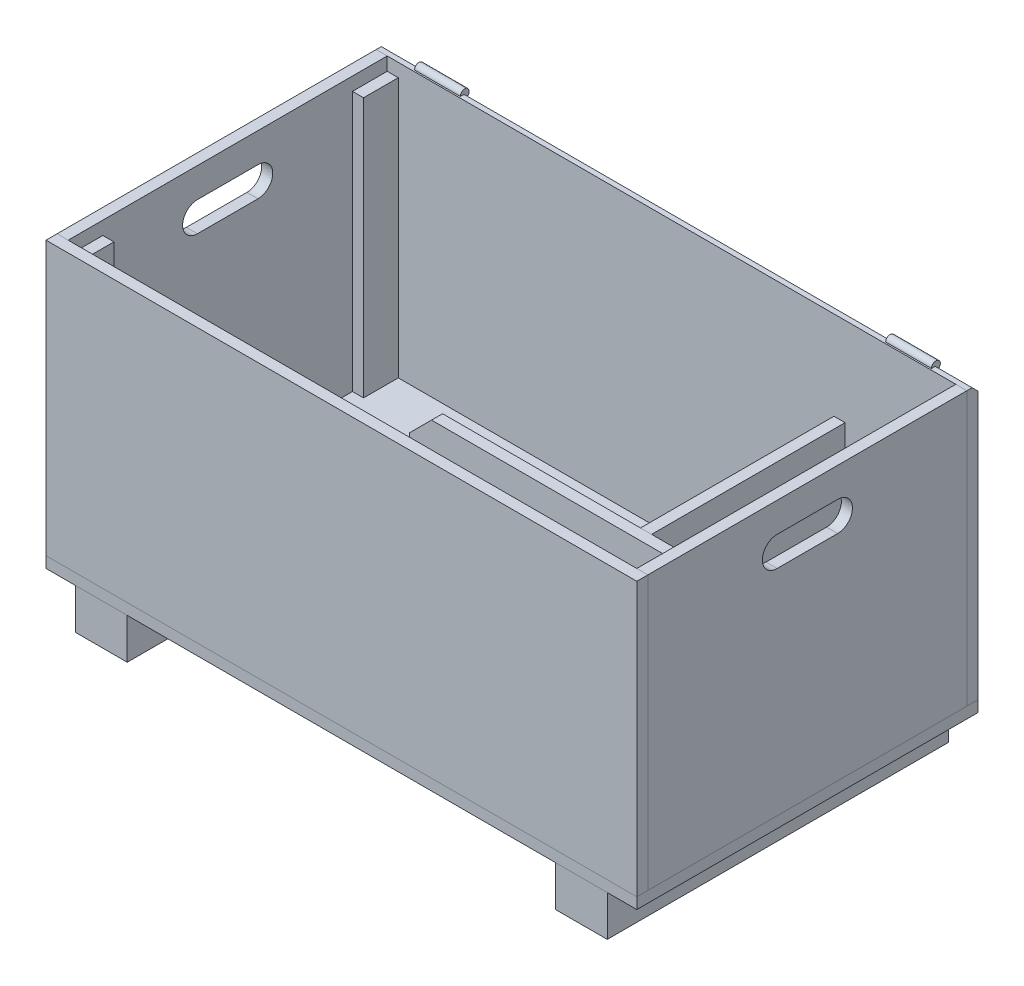
from build123d import *

# Parameters (mm, degrees)
ESQUISSE1_W             = 800
ESQUISSE1_H             = 462
BOSS_EXTRU_1_DEPTH      = 15
ESQUISSE2_W             = 70
ESQUISSE2_H             = 55
BOSS_EXTRU_2_DEPTH      = 462
BOSS_EXTRU_2_2_DEPTH    = 462
ESQUISSE3_W             = 800
ESQUISSE3_H             = 15
BOSS_EXTRU_3_DEPTH      = 370
BOSS_EXTRU_3_2_DEPTH    = 370
ESQUISSE4_W             = 15
ESQUISSE4_H             = 432
BOSS_EXTRU_4_DEPTH      = 370
BOSS_EXTRU_4_2_DEPTH    = 370
ESQUISSE5_W             = 15
ESQUISSE5_H             = 47
BOSS_EXTRU_5_DEPTH      = 352
BOSS_EXTRU_5_2_DEPTH    = 352
BOSS_EXTRU_5_3_DEPTH    = 352
BOSS_EXTRU_5_4_DEPTH    = 352
ENL_V_MAT_EXTRU_1_DEPTH = 918.3799649
BOSS_EXTRU_7_START      = -50
ESQUISSE8_R             = 6
BOSS_EXTRU_7_DEPTH      = 62
CHANFREIN1_SIZE         = 8
ESQUISSE9_W             = 15
ESQUISSE9_H             = 155
BOSS_EXTRU_8_DEPTH      = 130
BOSS_EXTRU_8_2_DEPTH    = 130
ESQUISSE10_W            = 463
ESQUISSE10_H            = 15
BOSS_EXTRU_9_DEPTH      = 250
ESQUISSE11_W            = 15
ESQUISSE11_H            = 262
BOSS_EXTRU_10_DEPTH     = 250
CHANFREIN2_SIZE         = 30
ESQUISSE12_R            = 1
ENL_V_MAT_EXTRU_2_DEPTH = 15


with BuildPart() as part:
    # Esquisse1 → Boss.-Extru.1 (new body)
    with BuildSketch(Plane(origin=(0, 0, 0), x_dir=(1, 0, 0), z_dir=(0, 1, 0))):
        Rectangle(ESQUISSE1_W, ESQUISSE1_H)
    extrude(amount=BOSS_EXTRU_1_DEPTH)

    # Esquisse12 → Enlèv. mat.-Extru.2 (cut)
    with BuildSketch(Plane(origin=(0, 15, 0), x_dir=(1, 0, 0), z_dir=(0, 1, 0))):
        with Locations(Location((-243.5, 140.5, 0), (0, 0, 270))):
            Circle(ESQUISSE12_R)
        with Locations(Location((-48.5, 123.5, 0), (0, 0, 270))):
            Circle(ESQUISSE12_R)
        with Locations(Location((-146.5, 140.5, 0), (0, 0, 90))):
            Circle(ESQUISSE12_R)
        with Locations(Location((192.5, 123.5, 0), (0, 0, 90))):
            Circle(ESQUISSE12_R)
        with Locations(Location((-48.5, 6.5, 0), (0, 0, 90))):
            Circle(ESQUISSE12_R)
        with Locations(Location((192.5, 6.5, 0), (0, 0, 270))):
            Circle(ESQUISSE12_R)
        with Locations(Location((-243.5, -170.5, 0), (0, 0, 90))):
            Circle(ESQUISSE12_R)
        with Locations(Location((-146.5, -170.5, 0), (0, 0, 270))):
            Circle(ESQUISSE12_R)
        with Locations(Location((-340, -15, 0), (0, 0, 270))):
            Circle(ESQUISSE12_R)
    extrude(amount=-ENL_V_MAT_EXTRU_2_DEPTH, mode=Mode.SUBTRACT)


with BuildPart() as body_2:
    # Esquisse2 → Boss.-Extru.2 (new body)
    with BuildSketch(Plane.XY.offset(231)):
        with Locations((-325, -27.5)):
            Rectangle(ESQUISSE2_W, ESQUISSE2_H)
    extrude(amount=-BOSS_EXTRU_2_DEPTH)


with BuildPart() as body_3:
    # Esquisse2 → Boss.-Extru.2 2 (new body)
    with BuildSketch(Plane.XY.offset(231)):
        with Locations((325, -27.5)):
            Rectangle(ESQUISSE2_W, ESQUISSE2_H)
    extrude(amount=-BOSS_EXTRU_2_2_DEPTH)


with BuildPart() as body_4:
    # Esquisse3 → Boss.-Extru.3 (new body)
    with BuildSketch(Plane(origin=(0, 15, 0), x_dir=(1, 0, 0), z_dir=(0, 1, 0))):
        with Locations((0, 223.5)):
            Rectangle(ESQUISSE3_W, ESQUISSE3_H)
    extrude(amount=BOSS_EXTRU_3_DEPTH)

    # Chanfrein1
    chanfrein1_edges = [body_4.edges().sort_by_distance(p)[0] for p in [
        (0, 385, -231),
    ]]
    chamfer(chanfrein1_edges, length=CHANFREIN1_SIZE)


with BuildPart() as body_5:
    # Esquisse3 → Boss.-Extru.3 2 (new body)
    with BuildSketch(Plane(origin=(0, 15, 0), x_dir=(1, 0, 0), z_dir=(0, 1, 0))):
        with Locations((0, -223.5)):
            Rectangle(ESQUISSE3_W, ESQUISSE3_H)
    extrude(amount=BOSS_EXTRU_3_2_DEPTH)


with BuildPart() as body_6:
    # Esquisse4 → Boss.-Extru.4 (new body)
    with BuildSketch(Plane(origin=(0, 15, 0), x_dir=(1, 0, 0), z_dir=(0, 1, 0))):
        with Locations((-392.5, 0)):
            Rectangle(ESQUISSE4_W, ESQUISSE4_H)
    extrude(amount=BOSS_EXTRU_4_DEPTH)


with BuildPart() as body_7:
    # Esquisse4 → Boss.-Extru.4 2 (new body)
    with BuildSketch(Plane(origin=(0, 15, 0), x_dir=(1, 0, 0), z_dir=(0, 1, 0))):
        with Locations((392.5, 0)):
            Rectangle(ESQUISSE4_W, ESQUISSE4_H)
    extrude(amount=BOSS_EXTRU_4_2_DEPTH)


with BuildPart() as body_8:
    # Esquisse5 → Boss.-Extru.5 (new body)
    with BuildSketch(Plane(origin=(0, 15, 0), x_dir=(1, 0, 0), z_dir=(0, 1, 0))):
        with Locations((-377.5, 192.5)):
            Rectangle(ESQUISSE5_W, ESQUISSE5_H)
    extrude(amount=BOSS_EXTRU_5_DEPTH)


with BuildPart() as body_9:
    # Esquisse5 → Boss.-Extru.5 2 (new body)
    with BuildSketch(Plane(origin=(0, 15, 0), x_dir=(1, 0, 0), z_dir=(0, 1, 0))):
        with Locations((-377.5, -192.5)):
            Rectangle(ESQUISSE5_W, ESQUISSE5_H)
    extrude(amount=BOSS_EXTRU_5_2_DEPTH)


with BuildPart() as body_10:
    # Esquisse5 → Boss.-Extru.5 3 (new body)
    with BuildSketch(Plane(origin=(0, 15, 0), x_dir=(1, 0, 0), z_dir=(0, 1, 0))):
        with Locations((377.5, -192.5)):
            Rectangle(ESQUISSE5_W, ESQUISSE5_H)
    extrude(amount=BOSS_EXTRU_5_3_DEPTH)


with BuildPart() as body_11:
    # Esquisse5 → Boss.-Extru.5 4 (new body)
    with BuildSketch(Plane(origin=(0, 15, 0), x_dir=(1, 0, 0), z_dir=(0, 1, 0))):
        with Locations((377.5, 192.5)):
            Rectangle(ESQUISSE5_W, ESQUISSE5_H)
    extrude(amount=BOSS_EXTRU_5_4_DEPTH)


with BuildPart() as enl_v_mat_extru_1_tool:
    # Esquisse6 → Enlèv. mat.-Extru.1 (new, through all)
    with BuildSketch(Plane.ZY.offset(400)):
        with BuildLine():
            Line((-41, 345), (41, 345))
            ThreePointArc((41, 345), (61, 325), (41, 305))
            Line((41, 305), (-41, 305))
            ThreePointArc((-41, 305), (-61, 325), (-41, 345))
        make_face()
    extrude(amount=-ENL_V_MAT_EXTRU_1_DEPTH)


with BuildPart() as body_6_1:
    add(body_6.part)

    # Enlèv. mat.-Extru.1: cut by enl_v_mat_extru_1_tool
    add(enl_v_mat_extru_1_tool.part, mode=Mode.SUBTRACT)


with BuildPart() as body_7_1:
    add(body_7.part)

    # Enlèv. mat.-Extru.1: cut by enl_v_mat_extru_1_tool
    add(enl_v_mat_extru_1_tool.part, mode=Mode.SUBTRACT)


with BuildPart() as body_12:
    # Esquisse8 → Boss.-Extru.7 (new body)
    with BuildSketch(Plane.ZY.offset(400).offset(BOSS_EXTRU_7_START)):
        with Locations((-224, 385)):
            Circle(ESQUISSE8_R)
    extrude(amount=-BOSS_EXTRU_7_DEPTH)


with BuildPart() as body_13:
    # Symétrie3: mirrored copy
    add(body_12.part.mirror(Plane(origin=(0, 0, 0), x_dir=(0, 0, 1), z_dir=(1, 0, 0))))


with BuildPart() as body_14:
    # Esquisse9 → Boss.-Extru.8 (new body)
    with BuildSketch(Plane(origin=(0, 15, 0), x_dir=(1, 0, 0), z_dir=(0, 1, 0))):
        with Locations((-70.5, -138.5)):
            Rectangle(ESQUISSE9_W, ESQUISSE9_H)
    extrude(amount=BOSS_EXTRU_8_DEPTH)


with BuildPart() as body_15:
    # Esquisse9 → Boss.-Extru.8 2 (new body)
    with BuildSketch(Plane(origin=(0, 15, 0), x_dir=(1, 0, 0), z_dir=(0, 1, 0))):
        with Locations((362.5, -138.5)):
            Rectangle(ESQUISSE9_W, ESQUISSE9_H)
    extrude(amount=BOSS_EXTRU_8_2_DEPTH)


with BuildPart() as body_16:
    # Esquisse10 → Boss.-Extru.9 (new body)
    with BuildSketch(Plane(origin=(0, 15, 0), x_dir=(1, 0, 0), z_dir=(0, 1, 0))):
        with Locations((153.5, -53.5)):
            Rectangle(ESQUISSE10_W, ESQUISSE10_H)
    extrude(amount=BOSS_EXTRU_9_DEPTH)

    # Chanfrein2
    chanfrein2_edges = [body_16.edges().sort_by_distance(p)[0] for p in [
        (-78, 265, 53.5),
    ]]
    chamfer(chanfrein2_edges, length=CHANFREIN2_SIZE)


with BuildPart() as body_17:
    # Esquisse11 → Boss.-Extru.10 (new body)
    with BuildSketch(Plane(origin=(0, 15, 0), x_dir=(1, 0, 0), z_dir=(0, 1, 0))):
        with Locations((227.5, 85)):
            Rectangle(ESQUISSE11_W, ESQUISSE11_H)
    extrude(amount=BOSS_EXTRU_10_DEPTH)


solid = Compound([part.part, body_2.part, body_3.part, body_4.part, body_5.part, body_8.part, body_9.part, body_10.part, body_11.part, body_6_1.part, body_7_1.part, body_12.part, body_13.part, body_14.part, body_15.part, body_16.part, body_17.part])
